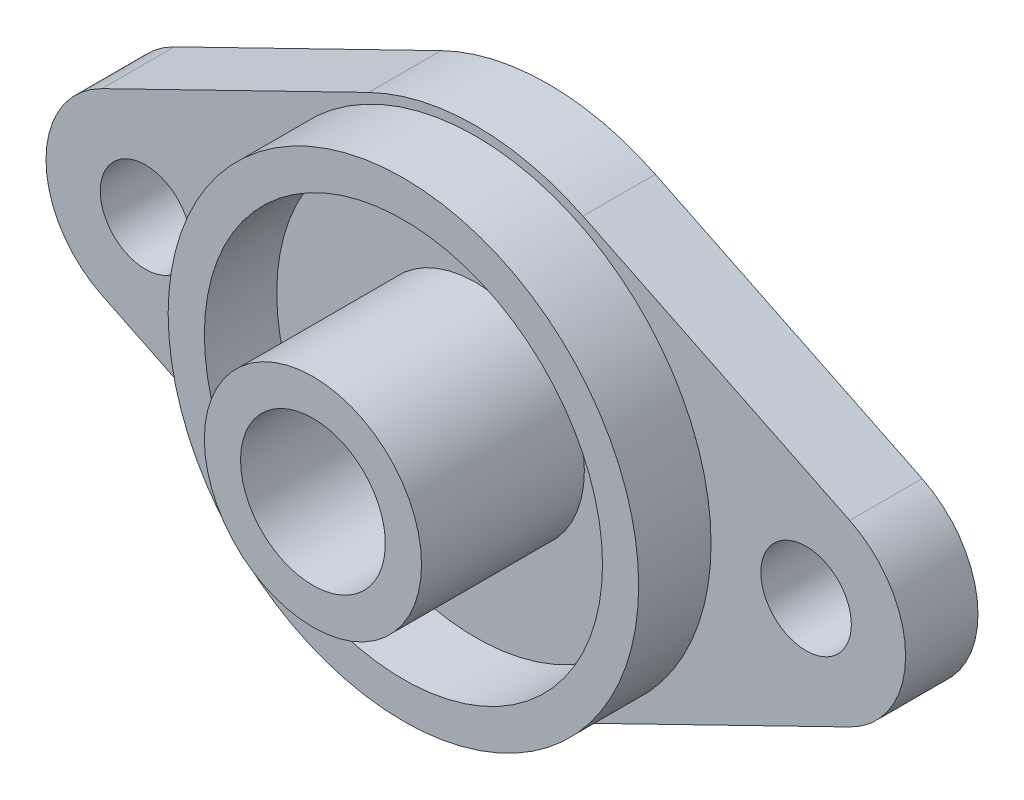
from build123d import *

# Parameters (mm, degrees)
BOSS_EXTRUDE5_DEPTH       = 4
SKETCH5_W                 = 2
SKETCH5_H                 = 4
F_5_0MM_DOWEL_HOLE1_D     = 5
F_5_0MM_DOWEL_HOLE1_DEPTH = 10.1
F_5_0MM_DOWEL_HOLE1_TIP   = 1.502151548
F_8_0MM_DOWEL_HOLE1_D     = 8
F_8_0MM_DOWEL_HOLE1_DEPTH = 10.1
F_8_0MM_DOWEL_HOLE1_TIP   = 2.403442476


with BuildPart() as part:
    # Sketch1 → Boss-Extrude5 (new body)
    with BuildSketch(Plane.XY):
        with BuildLine():
            Line((-20.660958904, 4.943407445), (-5.917808219, 12.133818273))
            ThreePointArc((-5.917808219, 12.133818273), (0, 13.5), (5.917808219, 12.133818273))
            Line((5.917808219, 12.133818273), (20.660958904, 4.943407445))
            ThreePointArc((20.660958904, 4.943407445), (23.75, 0), (20.660958904, -4.943407445))
            Line((20.660958904, -4.943407445), (5.917808219, -12.133818273))
            ThreePointArc((5.917808219, -12.133818273), (0, -13.5), (-5.917808219, -12.133818273))
            Line((-5.917808219, -12.133818273), (-20.660958904, -4.943407445))
            ThreePointArc((-20.660958904, -4.943407445), (-23.75, 0), (-20.660958904, 4.943407445))
        make_face()
    extrude(amount=BOSS_EXTRUDE5_DEPTH)

    # Sketch5 → Revolve2 (revolve)
    with BuildSketch(Plane(origin=(0, 0, 0), x_dir=(1, 0, 0), z_dir=(0, 1, 0)), mode=Mode.PRIVATE) as revolve2_sk:
        Polygon((4, -13), (6, -13), (6, -10.51697017), (6, -4), (4, -4), align=None)
        with Locations((12, -6)):
            Rectangle(SKETCH5_W, SKETCH5_H)
    revolve(revolve2_sk.sketch.rotate(Axis((0, 0, -13.433754879), (0, 0, 1)), 180), axis=Axis((0, 0, -13.433754879), (0, 0, 1)))

    # Ø5.0mm Dowel Hole1
    with Locations(Plane(origin=(0, 0, 0), x_dir=(1, 0, 0), z_dir=(0, 0, -1))):
        with Locations((18.25, 0), (-18.25, 0)):
            Hole(F_5_0MM_DOWEL_HOLE1_D / 2, depth=F_5_0MM_DOWEL_HOLE1_DEPTH)
            with Locations((0, 0, -(F_5_0MM_DOWEL_HOLE1_DEPTH + F_5_0MM_DOWEL_HOLE1_TIP / 2))):  # 118° drill point
                Cone(0, F_5_0MM_DOWEL_HOLE1_D / 2, F_5_0MM_DOWEL_HOLE1_TIP, mode=Mode.SUBTRACT)

    # Ø8.0mm Dowel Hole1
    with Locations(Plane.XY.offset(4)):
        with Locations((0, 0)):
            Hole(F_8_0MM_DOWEL_HOLE1_D / 2, depth=F_8_0MM_DOWEL_HOLE1_DEPTH)
            with Locations((0, 0, -(F_8_0MM_DOWEL_HOLE1_DEPTH + F_8_0MM_DOWEL_HOLE1_TIP / 2))):  # 118° drill point
                Cone(0, F_8_0MM_DOWEL_HOLE1_D / 2, F_8_0MM_DOWEL_HOLE1_TIP, mode=Mode.SUBTRACT)


solid = part.part
